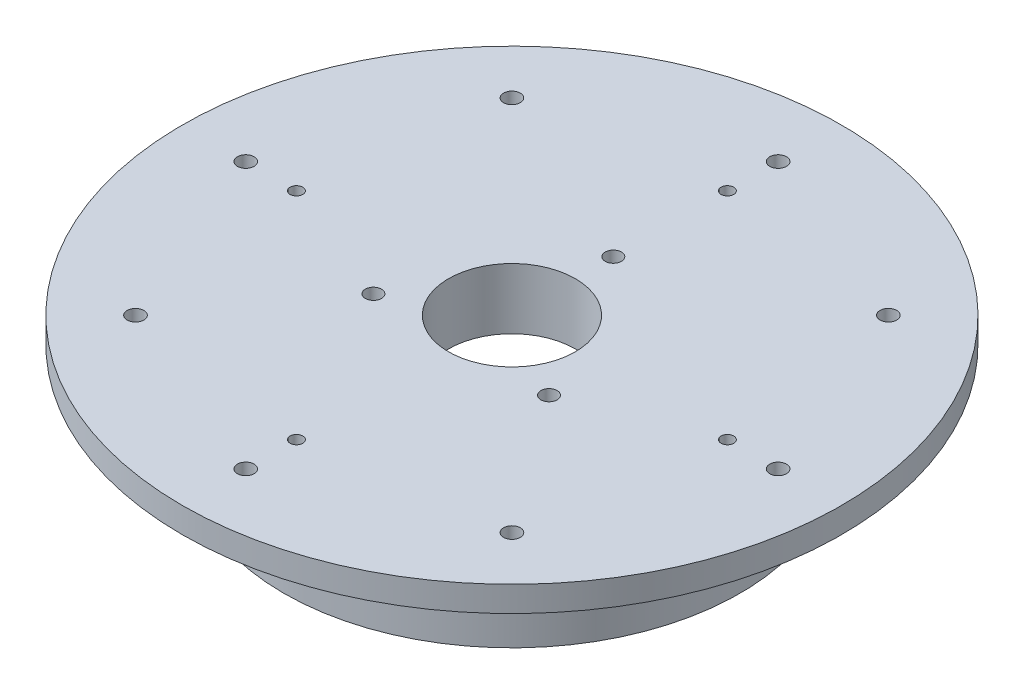
from build123d import *

# Parameters (mm, degrees)
SKETCH_1_R             = 65
EXTRUDE_1_DEPTH        = 5
SKETCH_2_R             = 50
EXTRUDE_2_DEPTH        = 7
SKETCH_3_R             = 1.6
CUT_EXTRUDE_1_DEPTH    = 58
SKETCH_4_R             = 12.5
CUT_EXTRUDE_2_DEPTH    = 93.703829479
SKETCH_5_R             = 45
SKETCH_5_R_2           = 40
EXTRUDE_3_DEPTH        = 13
HOLE_WIZARD_M3_1_D     = 2.5
SKETCH_9_R             = 1.6
CUT_EXTRUDE_3_DEPTH    = 10
HOLE_WIZARD_M4_3_D     = 3.3
HOLE_WIZARD_M4_3_DEPTH = 9.5
HOLE_WIZARD_M4_3_TIP   = 0.991420021


with BuildPart() as part:
    # 草图1 → 凸台-拉伸1 (new body)
    with BuildSketch(Plane(origin=(0, 0, 0), x_dir=(1, 0, 0), z_dir=(0, 1, 0))):
        with Locations(Location((0, 0, 0), (0, 0, 270))):
            Circle(SKETCH_1_R)
    extrude(amount=EXTRUDE_1_DEPTH)

    # 草图2 → 凸台-拉伸2 (add)
    with BuildSketch(Plane(origin=(0, 0, 0), x_dir=(-1, 0, 0), z_dir=(0, -1, 0))):
        with Locations(Location((0, 0, 0), (0, 0, 90))):
            Circle(SKETCH_2_R)
    extrude(amount=EXTRUDE_2_DEPTH)

    # 草图3 → 切除-拉伸1 (cut)
    with BuildSketch(Plane(origin=(0, 5, 0), x_dir=(1, 0, 0), z_dir=(0, 1, 0))):
        with Locations(Location((0, 20, 0), (0, 0, 270))):
            Circle(SKETCH_3_R)
        with Locations(Location((17.320508076, -10, 0), (0, 0, 270))):
            Circle(SKETCH_3_R)
        with Locations(Location((-17.320508076, -10, 0), (0, 0, 270))):
            Circle(SKETCH_3_R)
    extrude(amount=-CUT_EXTRUDE_1_DEPTH, mode=Mode.SUBTRACT)

    # 草图4 → 切除-拉伸2 (cut, through all)
    with BuildSketch(Plane(origin=(0, -7, 0), x_dir=(-1, 0, 0), z_dir=(0, -1, 0))):
        with Locations(Location((0, 0, 0), (0, 0, 90))):
            Circle(SKETCH_4_R)
    extrude(amount=-CUT_EXTRUDE_2_DEPTH, mode=Mode.SUBTRACT)

    # 草图5 → 凸台-拉伸3 (add)
    with BuildSketch(Plane(origin=(0, -7, 0), x_dir=(-1, 0, 0), z_dir=(0, -1, 0))):
        with Locations(Location((0, 0, 0), (0, 0, 270))):
            Circle(SKETCH_5_R)
        with Locations(Location((0, 0, 0), (0, 0, 270))):
            Circle(SKETCH_5_R_2, mode=Mode.SUBTRACT)
    extrude(amount=EXTRUDE_3_DEPTH)

    # M3 螺纹孔1 (through all)
    with Locations(Plane(origin=(0, -20, 42.5), x_dir=(0, 0, -1), z_dir=(0, -1, 0))):
        with Locations((0, 0), (42.5, -42.5), (85, 0), (42.5, 42.5)):
            Hole(HOLE_WIZARD_M3_1_D / 2)

    # 草图9 → 切除-拉伸3 (cut)
    with BuildSketch(Plane(origin=(0, 5, 0), x_dir=(1, 0, 0), z_dir=(0, 1, 0))):
        with Locations(Location((0, 52.5, 0), (0, 0, 270))):
            Circle(SKETCH_9_R)
        with Locations(Location((37.123106012, 37.123106012, 0), (0, 0, 270))):
            Circle(SKETCH_9_R)
        with Locations(Location((52.5, 0, 0), (0, 0, 270))):
            Circle(SKETCH_9_R)
        with Locations(Location((37.123106012, -37.123106012, 0), (0, 0, 270))):
            Circle(SKETCH_9_R)
        with Locations(Location((0, -52.5, 0), (0, 0, 270))):
            Circle(SKETCH_9_R)
        with Locations(Location((-37.123106012, -37.123106012, 0), (0, 0, 270))):
            Circle(SKETCH_9_R)
        with Locations(Location((-52.5, 0, 0), (0, 0, 270))):
            Circle(SKETCH_9_R)
        with Locations(Location((-37.123106012, 37.123106012, 0), (0, 0, 270))):
            Circle(SKETCH_9_R)
    extrude(amount=-CUT_EXTRUDE_3_DEPTH, mode=Mode.SUBTRACT)

    # M4 螺纹孔3
    with Locations(Plane(origin=(0, 5, -52.5), x_dir=(0, 0, 1), z_dir=(0, 1, 0))):
        with Locations((0, 0), (15.376893988, 37.123106012), (52.5, 52.5), (89.623106012, 37.123106012), (105, 0), (89.623106012, -37.123106012), (52.5, -52.5), (15.376893988, -37.123106012)):
            Hole(HOLE_WIZARD_M4_3_D / 2, depth=HOLE_WIZARD_M4_3_DEPTH)
            with Locations((0, 0, -(HOLE_WIZARD_M4_3_DEPTH + HOLE_WIZARD_M4_3_TIP / 2))):  # 118° drill point
                Cone(0, HOLE_WIZARD_M4_3_D / 2, HOLE_WIZARD_M4_3_TIP, mode=Mode.SUBTRACT)


solid = part.part
